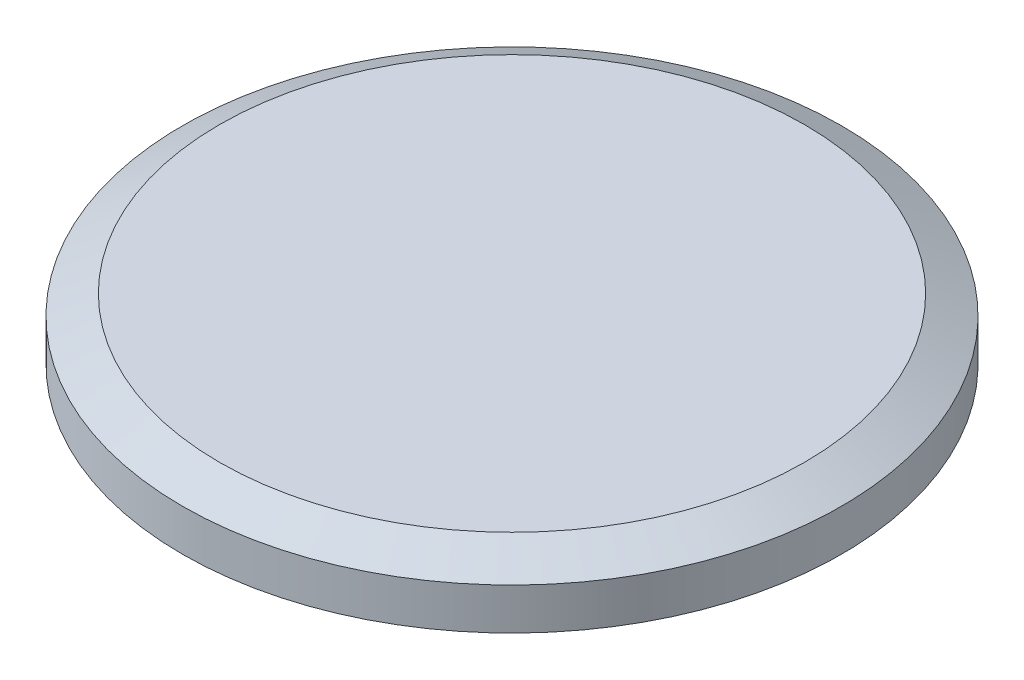
from build123d import *


with BuildPart() as part:
    # Sketch1 → Revolve1 (revolve)
    with BuildSketch(Plane.XY, mode=Mode.PRIVATE) as revolve1_sk:
        Polygon((0, 6.4474909), (0, 12.6474909), (22.5, 12.6474909), (25.35, 11.1474909), (25.35, 7.9474909), (22.5, 6.4474909), align=None)
    revolve(revolve1_sk.sketch.rotate(Axis((0, 6.4474909, 0), (0, 1, 0)), 90), axis=Axis((0, 6.4474909, 0), (0, 1, 0)))


solid = part.part
